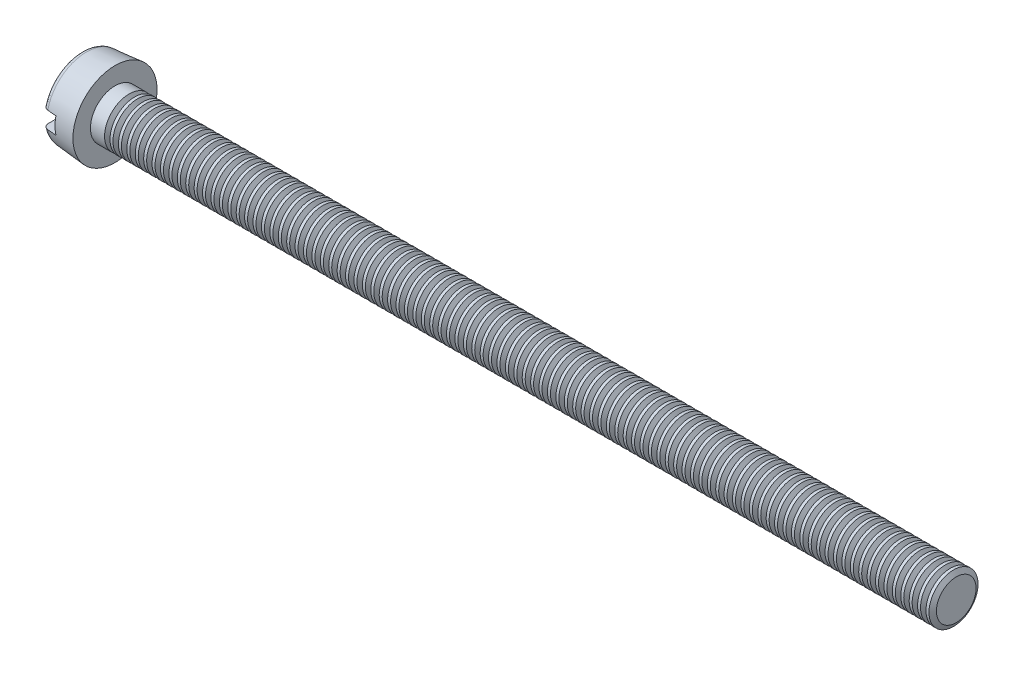
from build123d import *

# Parameters (mm, degrees)
FILLET1_R       = 0.4
SLOTSKE_W       = 6
SLOTSKE_H       = 1.2
SLOT_DEPTH      = 1
THDSCHPAT_COUNT = 99
THDSCHPAT_PITCH = 0.6


with BuildPart() as part:
    # BodySke → BaseBody (revolve)
    with BuildSketch(Plane.XY, mode=Mode.PRIVATE) as basebody_sk:
        Polygon((0, 0), (0, 2.790027208), (2.4, 3), (2.4, 1.75), (62.4, 1.75), (62.4, 0), align=None)
    revolve(basebody_sk.sketch.rotate(Axis((0, 0, 0), (1, 0, 0)), 90), axis=Axis((0, 0, 0), (1, 0, 0)))

    # Fillet1
    fillet1_edges = [part.edges().sort_by_distance(p)[0] for p in [
        (0, 0, -2.790027208),
    ]]
    fillet(fillet1_edges, radius=FILLET1_R)

    # SlotSke → Slot (cut)
    with BuildSketch(Plane.ZY):
        Rectangle(SLOTSKE_W, SLOTSKE_H)
    extrude(amount=-SLOT_DEPTH, mode=Mode.SUBTRACT)

    # ThdSchSke → ThreadSchematic (revolve, cut)
    with BuildSketch(Plane.XY, mode=Mode.PRIVATE) as threadschematic_sk:
        Polygon((62.206298985, 1.75), (62.206298985, 2.137402031), (62.593701015, 2.137402031), (62.593701015, 1.75), (62.4, 1.4145), align=None)
    threadschematic = revolve(threadschematic_sk.sketch.rotate(Axis((0, 0, 0), (1, 0, 0)), 90), axis=Axis((0, 0, 0), (1, 0, 0)), mode=Mode.SUBTRACT)

    # ThdSchPat: ThreadSchematic ×99
    with Locations(*[(-i * THDSCHPAT_PITCH, 0, 0) for i in range(1, THDSCHPAT_COUNT)]):
        add(threadschematic, mode=Mode.SUBTRACT)


solid = part.part
